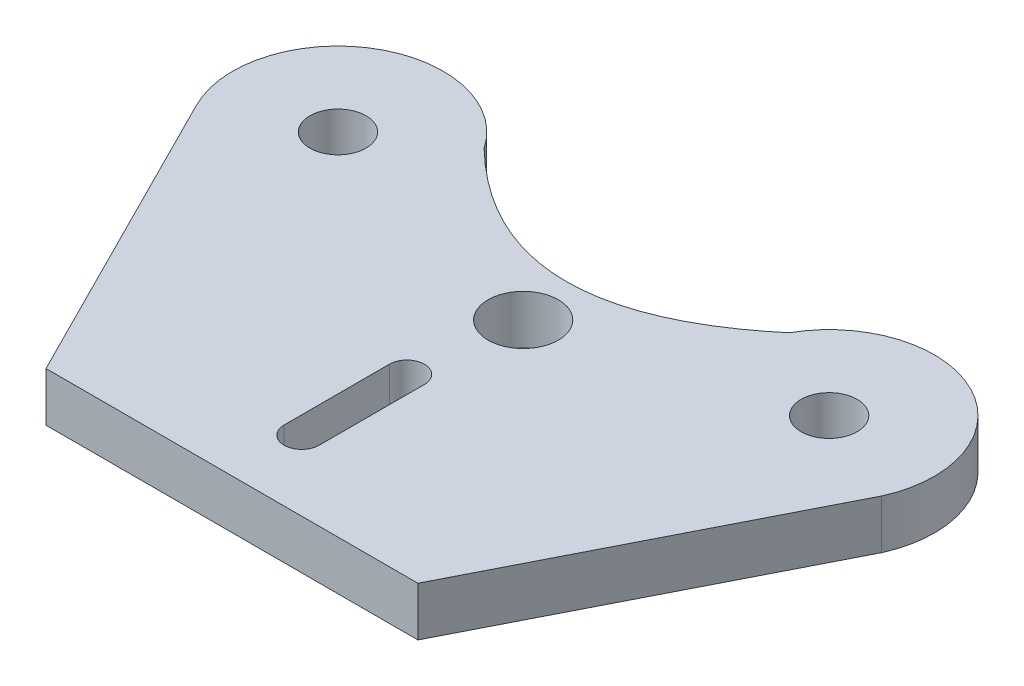
from build123d import *

# Parameters (mm, degrees)
BOSS_EXTRUDE1_DEPTH = 8.89
CUT_EXTRUDE1_DEPTH  = 8.89
SKETCH3_R           = 5.08
CUT_EXTRUDE2_DEPTH  = 8.89
SKETCH4_R           = 5.08
CUT_EXTRUDE3_DEPTH  = 8.89
SKETCH5_R           = 6.35
CUT_EXTRUDE4_DEPTH  = 8.89


with BuildPart() as part:
    # Sketch1 → Boss-Extrude1 (new body)
    with BuildSketch(Plane(origin=(0, 0, 0), x_dir=(1, 0, 0), z_dir=(0, 1, 0))):
        with BuildLine():
            Line((-17.012597889, -8.571698377), (10.66270702, -63.5))
            Line((10.66270702, -63.5), (77.97270702, -63.5))
            Line((77.97270702, -63.5), (105.474181334, -9.391432964))
            Line((105.474181334, -9.391432964), (106.255653047, -7.853903954))
            ThreePointArc((106.255653047, -7.853903954), (97.513383696, 16.99153087), (72.305806006, 9.35602617))
            add(Edge.make_bspline(
                [(15.794561963, 10.650554558), (42.737740309, -15.557403772), (72.305806006, 9.35602617)],
                knots=[0, 0, 0, 1, 1, 1], degree=2))
            ThreePointArc((15.794561963, 10.650554558), (-9.630402632, 16.436479098), (-17.012597889, -8.571698377))
        make_face()
    extrude(amount=BOSS_EXTRUDE1_DEPTH)

    # Sketch2 → Cut-Extrude1 (cut)
    with BuildSketch(Plane(origin=(0, 8.89, 0), x_dir=(1, 0, 0), z_dir=(0, 1, 0))):
        with BuildLine():
            Line((47.406198559, -31.75), (47.406198559, -50.8))
            ThreePointArc((47.406198559, -50.8), (44.231198559, -53.975), (41.056198559, -50.8))
            Line((41.056198559, -50.8), (41.056198559, -31.75))
            ThreePointArc((41.056198559, -31.75), (44.231198559, -28.575), (47.406198559, -31.75))
        make_face()
    extrude(amount=-CUT_EXTRUDE1_DEPTH, mode=Mode.SUBTRACT)

    # Sketch3 → Cut-Extrude2 (cut)
    with BuildSketch(Plane(origin=(0, 8.89, 0), x_dir=(1, 0, 0), z_dir=(0, 1, 0))):
        with Locations(Location((0, 0, 0), (0, 0, 270))):
            Circle(SKETCH3_R)
    extrude(amount=-CUT_EXTRUDE2_DEPTH, mode=Mode.SUBTRACT)

    # Sketch4 → Cut-Extrude3 (cut)
    with BuildSketch(Plane(origin=(0, 8.89, 0), x_dir=(1, 0, 0), z_dir=(0, 1, 0))):
        with Locations(Location((88.9, 0, 0), (0, 0, 270))):
            Circle(SKETCH4_R)
    extrude(amount=-CUT_EXTRUDE3_DEPTH, mode=Mode.SUBTRACT)

    # Sketch5 → Cut-Extrude4 (cut)
    with BuildSketch(Plane(origin=(0, 8.89, 0), x_dir=(1, 0, 0), z_dir=(0, 1, 0))):
        with Locations(Location((46.230762454, -12.7, 0), (0, 0, 270))):
            Circle(SKETCH5_R)
    extrude(amount=-CUT_EXTRUDE4_DEPTH, mode=Mode.SUBTRACT)


solid = part.part
